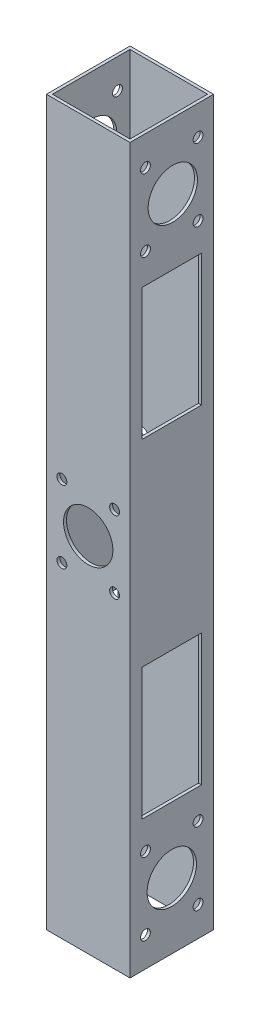
from build123d import *

# Parameters (mm, degrees)
SKETCH1_W           = 25.4
SKETCH1_H           = 25.4
SKETCH1_W_2         = 23.6
SKETCH1_H_2         = 23.6
BOSS_EXTRUDE1_DEPTH = 220
SKETCH2_R           = 7.5
CUT_EXTRUDE1_DEPTH  = 25.4
SKETCH3_R           = 7.5
SKETCH3_W           = 18
SKETCH3_H           = 40
CUT_EXTRUDE2_DEPTH  = 25.4
SKETCH5_R           = 1.5
CUT_EXTRUDE4_DEPTH  = 25.4
SKETCH4_R           = 1.5
CUT_EXTRUDE5_DEPTH  = 25.4


with BuildPart() as part:
    # Sketch1 → Boss-Extrude1 (new body)
    with BuildSketch(Plane(origin=(0, 0, 0), x_dir=(1, 0, 0), z_dir=(0, 1, 0))):
        Rectangle(SKETCH1_W, SKETCH1_H)
        Rectangle(SKETCH1_W_2, SKETCH1_H_2, mode=Mode.SUBTRACT)
    extrude(amount=BOSS_EXTRUDE1_DEPTH)

    # Sketch2 → Cut-Extrude1 (cut)
    with BuildSketch(Plane(origin=(0, 0, -12.7), x_dir=(-1, 0, 0), z_dir=(0, 0, -1))):
        with Locations((0, 110)):
            Circle(SKETCH2_R)
    extrude(amount=-CUT_EXTRUDE1_DEPTH, mode=Mode.SUBTRACT)

    # Sketch3 → Cut-Extrude2 (cut)
    with BuildSketch(Plane(origin=(12.7, 0, 0), x_dir=(0, 0, -1), z_dir=(1, 0, 0))):
        with Locations((0, 20)):
            Circle(SKETCH3_R)
        with Locations(Location((0.307032613, 200, 0), (0, 0, 180))):
            Circle(SKETCH3_R)
        with Locations((0, 60)):
            Rectangle(SKETCH3_W, SKETCH3_H)
        with Locations((0, 160)):
            Rectangle(SKETCH3_W, SKETCH3_H)
    extrude(amount=-CUT_EXTRUDE2_DEPTH, mode=Mode.SUBTRACT)

    # Sketch5 → Cut-Extrude4 (cut)
    with BuildSketch(Plane(origin=(0, 0, -12.7), x_dir=(-1, 0, 0), z_dir=(0, 0, -1))):
        with Locations((8, 99)):
            Circle(SKETCH5_R)
        with Locations((8, 121)):
            Circle(SKETCH5_R)
        with Locations((-8, 121)):
            Circle(SKETCH5_R)
        with Locations((-8, 99)):
            Circle(SKETCH5_R)
    extrude(amount=-CUT_EXTRUDE4_DEPTH, mode=Mode.SUBTRACT)

    # Sketch4 → Cut-Extrude5 (cut)
    with BuildSketch(Plane.ZY.offset(12.7)):
        with Locations((8, 9)):
            Circle(SKETCH4_R)
        with Locations((8, 31)):
            Circle(SKETCH4_R)
        with Locations((-8, 9)):
            Circle(SKETCH4_R)
        with Locations((-8, 31)):
            Circle(SKETCH4_R)
        with Locations((8, 211)):
            Circle(SKETCH4_R)
        with Locations((-8, 211)):
            Circle(SKETCH4_R)
        with Locations((8, 189)):
            Circle(SKETCH4_R)
        with Locations((-8, 189)):
            Circle(SKETCH4_R)
    extrude(amount=-CUT_EXTRUDE5_DEPTH, mode=Mode.SUBTRACT)


solid = part.part
